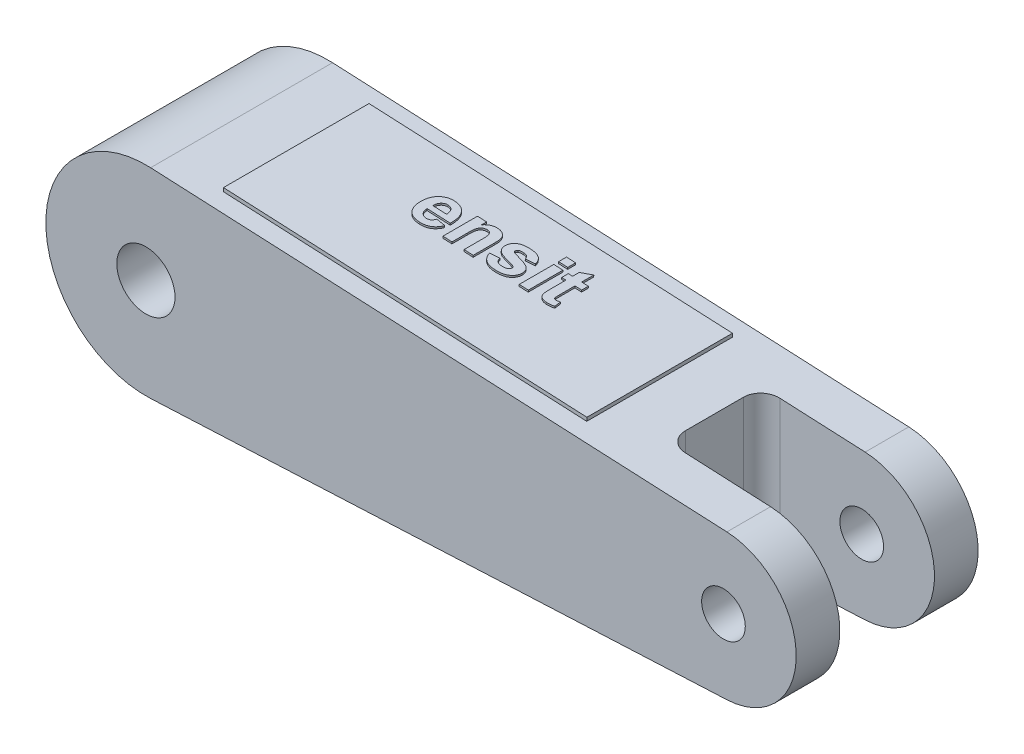
from build123d import *

# Parameters (mm, degrees)
BOSS_EXTRU_1_DEPTH           = 100
ESQUISSE2_R                  = 16
ESQUISSE2_R_2                = 12
ENL_V_MAT_EXTRU_1_DEPTH      = 376.274899241
ENL_V_MAT_EXTRU_2_DEPTH      = 376.274899241
ENL_V_MAT_EXTRU_2_DEPTH_BACK = 376.274899241
ESQUISSE4_W                  = 200
ESQUISSE4_H                  = 80
BOSS_EXTRU_2_DEPTH           = 2
ESQUISSE5_W                  = 5
ESQUISSE5_H                  = 4.333333333
ESQUISSE5_H_2                = 19
BOSS_EXTRU_3_DEPTH           = 1


with BuildPart() as part:
    # Esquisse1 → Boss.-Extru.1 (new body)
    with BuildSketch(Plane.XY):
        with BuildLine():
            Line((2.598425197, -54.938585589), (319.38976378, -39.955334974))
            ThreePointArc((319.38976378, -39.955334974), (357.5, 0), (319.38976378, 39.955334974))
            Line((319.38976378, 39.955334974), (2.598425197, 54.938585589))
            ThreePointArc((2.598425197, 54.938585589), (-55, 0), (2.598425197, -54.938585589))
        make_face()
    extrude(amount=-BOSS_EXTRU_1_DEPTH)

    # Esquisse2 → Enlèv. mat.-Extru.1 (cut, through all)
    with BuildSketch(Plane.XY):
        Circle(ESQUISSE2_R)
        with Locations((317.5, 0)):
            Circle(ESQUISSE2_R_2)
    extrude(amount=-ENL_V_MAT_EXTRU_1_DEPTH, mode=Mode.SUBTRACT)

    # Esquisse3 → Enlèv. mat.-Extru.2 (cut, two sides: drawn at the far end of the back side and taken through both)
    with BuildSketch(Plane(origin=(0, 0, 0), x_dir=(1, 0, 0), z_dir=(0, 1, 0)).offset(-ENL_V_MAT_EXTRU_2_DEPTH_BACK)):
        with BuildLine():
            Line((262.5, 66), (262.5, 34))
            ThreePointArc((262.5, 34), (265.428932188, 26.928932188), (272.5, 24))
            Line((272.5, 24), (370, 24))
            Line((370, 24), (370, 76))
            Line((370, 76), (272.5, 76))
            ThreePointArc((272.5, 76), (265.428932188, 73.071067812), (262.5, 66))
        make_face()
    extrude(amount=ENL_V_MAT_EXTRU_2_DEPTH + ENL_V_MAT_EXTRU_2_DEPTH_BACK, mode=Mode.SUBTRACT)

    # Esquisse4 → Boss.-Extru.2 (add)
    with BuildSketch(Plane(origin=(2.598425197, 54.938585589, 0), x_dir=(0.9988833743415652, -0.047244094488189, 0), z_dir=(0.047244094488189, 0.9988833743415652, 0))):
        with Locations((130, 50)):
            Rectangle(ESQUISSE4_W, ESQUISSE4_H)
    extrude(amount=BOSS_EXTRU_2_DEPTH)

    # Esquisse5 → Boss.-Extru.3 (add)
    # profile 1 of 6: a face of its own
    with BuildSketch(Plane(origin=(2.692913386, 56.936352337, 0), x_dir=(0.9988833743415652, -0.047244094488189024, 0), z_dir=(0.047244094488189024, 0.9988833743415652, 0))):
        with BuildLine():
            Line((101.333333333, 56), (106.333333333, 55.333333333))
            add(Edge.make_bspline(
                [(106.333333333, 55.333333333), (106.251551346, 55.108057373), (106.090750525, 54.665116811), (105.796966374, 54.033536922), (105.468573521, 53.444074923), (105.107150723, 52.893581334), (104.714043048, 52.381337922), (104.276251933, 51.918120116), (103.815104518, 51.486683863), (103.311311204, 51.107572755), (102.777495233, 50.766626183), (102.210973933, 50.468301541), (101.607216713, 50.22534271), (100.975366408, 50.021881126), (100.312554975, 49.859477833), (99.616078281, 49.745941967), (98.886829887, 49.676960923), (98.389043872, 49.670141324), (98.135416667, 49.666666667)],
                knots=[0, 0, 0, 0, 1.071172907, 2.106154283, 3.1104349, 4.085737425, 5.048416355, 5.993087888, 6.932482331, 7.868664062, 8.80754521, 9.762367971, 10.726735429, 11.713584758, 12.728370439, 13.774815933, 14.866245336, 16, 16, 16, 16], degree=3))
            add(Edge.make_bspline(
                [(98.135416667, 49.666666667), (97.739081692, 49.676448952), (96.96942933, 49.695445405), (95.855921218, 49.84810153), (94.821708921, 50.096644668), (93.864800572, 50.444777732), (92.988376739, 50.901440935), (92.191117703, 51.456733413), (91.471459927, 52.111861999), (91.06809061, 52.619092724), (90.864583333, 52.875)],
                knots=[0, 0, 0, 0, 1.150944905, 2.235047425, 3.25761485, 4.235688044, 5.185329112, 6.119879054, 7.051444229, 8, 8, 8, 8], degree=3))
            add(Edge.make_bspline(
                [(90.864583333, 52.875), (90.714394912, 53.092775543), (90.411959276, 53.531311911), (90.036020668, 54.24189506), (89.714561721, 54.992549804), (89.458467285, 55.785426333), (89.245581846, 56.617512111), (89.102349625, 57.494093352), (89.019794932, 58.413330485), (89.006687577, 59.039760609), (89, 59.359375)],
                knots=[0, 0, 0, 0, 0.92479112, 1.862259343, 2.806490716, 3.778329015, 4.774107667, 5.808532634, 6.881879269, 8, 8, 8, 8], degree=3))
            add(Edge.make_bspline(
                [(89, 59.359375), (89.00550005, 59.738248974), (89.016252058, 60.478906873), (89.14354719, 61.555569734), (89.323167913, 62.57369885), (89.597101625, 63.522716947), (89.939482118, 64.413449508), (90.369182941, 65.234442145), (90.864830929, 66.000628567), (91.444356698, 66.688869073), (92.07944613, 67.307705261), (92.755300416, 67.853003774), (93.476979063, 68.308472311), (94.233732851, 68.688627376), (95.038153592, 68.973181879), (95.880173234, 69.182651352), (96.763473382, 69.310215438), (97.365898547, 69.325546544), (97.671875, 69.333333333)],
                knots=[0, 0, 0, 0, 1.222152375, 2.389176539, 3.494777592, 4.555389183, 5.572001132, 6.56945427, 7.540785438, 8.511469914, 9.46642023, 10.399267108, 11.30862844, 12.215760073, 13.126777173, 14.056336669, 15.012798191, 16, 16, 16, 16], degree=3))
            add(Edge.make_bspline(
                [(97.671875, 69.333333333), (98.014324761, 69.326092962), (98.68446305, 69.311924315), (99.661522241, 69.178910403), (100.584034236, 68.962560133), (101.44898565, 68.651677207), (102.262016715, 68.2618451), (103.017080637, 67.778726915), (103.714216173, 67.206734623), (104.35170174, 66.546112115), (104.928637044, 65.801203276), (105.41969893, 64.957639402), (105.830785588, 64.024139438), (106.164059095, 62.998296685), (106.410444307, 61.877963519), (106.579031354, 60.666055507), (106.675173777, 59.362683863), (106.669561495, 58.463698678), (106.666666667, 58)],
                knots=[0, 0, 0, 0, 0.994942504, 1.946998194, 2.860087576, 3.744358974, 4.613292, 5.475605888, 6.343365869, 7.228414471, 8.138836547, 9.075277299, 10.058013037, 11.098483422, 12.205225682, 13.387753975, 14.652597341, 16, 16, 16, 16], degree=3))
            Line((106.666666667, 58), (94, 58))
            add(Edge.make_bspline(
                [(94, 58), (94.008199962, 57.821037197), (94.024167919, 57.472539215), (94.084653152, 56.963129329), (94.189363423, 56.486298141), (94.32639526, 56.039152777), (94.489339458, 55.621379472), (94.696617372, 55.236989896), (94.935428179, 54.881080254), (95.211508522, 54.559454391), (95.513793979, 54.273945198), (95.8327732, 54.023036711), (96.167956574, 53.803637158), (96.528003796, 53.636769797), (96.900944375, 53.495869132), (97.293491979, 53.405553837), (97.703019171, 53.34553951), (97.982414394, 53.337457751), (98.125, 53.333333333)],
                knots=[0, 0, 0, 0, 1.231756261, 2.398624542, 3.522625857, 4.583815436, 5.612473245, 6.600564899, 7.580690863, 8.554470542, 9.508734211, 10.435415665, 11.342824763, 12.255949018, 13.158633635, 14.07945191, 15.019874036, 16, 16, 16, 16], degree=3))
            add(Edge.make_bspline(
                [(98.125, 53.333333333), (98.314780387, 53.341748279), (98.682356679, 53.358046773), (99.21219318, 53.472241968), (99.692930926, 53.673484288), (100.129607279, 53.954039961), (100.518162263, 54.326618252), (100.843925361, 54.801171992), (101.128749372, 55.362886135), (101.262894904, 55.780641163), (101.333333333, 56)],
                knots=[0, 0, 0, 0, 1.004430367, 1.945431754, 2.851730883, 3.749038912, 4.678525969, 5.68064125, 6.782128749, 8, 8, 8, 8], degree=3))
        make_face()
        with BuildLine():
            add(Edge.make_bspline(
                [(101.666666667, 61), (101.658061356, 61.184132636), (101.641301912, 61.5427438), (101.58663317, 62.065598002), (101.492785492, 62.552935638), (101.369348251, 63.007384942), (101.204644577, 63.423351472), (101.020760971, 63.812757437), (100.795251193, 64.163477668), (100.536926211, 64.47470636), (100.264433584, 64.759179415), (99.963217183, 64.995737189), (99.658651912, 65.207438599), (99.334984393, 65.376835468), (98.99556772, 65.506254798), (98.641544933, 65.601407201), (98.272297649, 65.652393875), (98.022709098, 65.661856459), (97.895833333, 65.666666667)],
                knots=[0, 0, 0, 0, 1.317025077, 2.564998298, 3.752245872, 4.859831213, 5.924126069, 6.944952788, 7.932526842, 8.893486968, 9.832088588, 10.740700482, 11.624936399, 12.479435602, 13.343337491, 14.21592381, 15.09308328, 16, 16, 16, 16], degree=3))
            add(Edge.make_bspline(
                [(97.895833333, 65.666666667), (97.760244573, 65.662265414), (97.493060148, 65.653592524), (97.101242149, 65.597003527), (96.72985607, 65.49663307), (96.376071568, 65.360786734), (96.040646816, 65.181891339), (95.723574315, 64.962498201), (95.42366121, 64.705354097), (95.242949819, 64.510539332), (95.151041667, 64.411458333)],
                knots=[0, 0, 0, 0, 1.043516863, 2.056302107, 3.038302912, 3.998520634, 4.966791607, 5.956307719, 6.960596886, 8, 8, 8, 8], degree=3))
            add(Edge.make_bspline(
                [(95.151041667, 64.411458333), (95.065377095, 64.303742962), (94.893266292, 64.087329355), (94.674979049, 63.728506985), (94.4848357, 63.344967894), (94.343137583, 62.926356908), (94.218697887, 62.486240303), (94.145702327, 62.014099841), (94.096529212, 61.516690364), (94.091254469, 61.175483046), (94.088541667, 61)],
                knots=[0, 0, 0, 0, 0.903873942, 1.815995408, 2.755131859, 3.711650387, 4.716574161, 5.757841734, 6.846857195, 8, 8, 8, 8], degree=3))
            Line((94.088541667, 61), (101.666666667, 61))
        make_face(mode=Mode.SUBTRACT)
    # profile 2 of 6: a face of its own
    with BuildSketch(Plane(origin=(2.692913386, 56.936352337, 0), x_dir=(0.9988833743415652, -0.047244094488189024, 0), z_dir=(0.047244094488189024, 0.9988833743415652, 0))):
        with BuildLine():
            Line((127.333333333, 50), (122.333333333, 50))
            Line((122.333333333, 50), (122.333333333, 59.75))
            add(Edge.make_bspline(
                [(122.333333333, 59.75), (122.332585682, 59.996541694), (122.331158659, 60.467109366), (122.313736397, 61.137240213), (122.29497956, 61.739876647), (122.264826402, 62.273148929), (122.223410781, 62.740441495), (122.174127701, 63.138846595), (122.112049553, 63.469173929), (122.023970742, 63.813708612), (121.885675403, 64.17930852), (121.661231667, 64.557973135), (121.40104635, 64.894201837), (121.085861449, 65.169254941), (120.732624332, 65.391052651), (120.344783168, 65.55456302), (119.919503854, 65.650045222), (119.625489211, 65.661013682), (119.473958333, 65.666666667)],
                knots=[0, 0, 0, 0, 1.585090075, 3.025419896, 4.30986405, 5.461533023, 6.458985685, 7.325703005, 8.041573048, 8.618245387, 9.611190897, 10.541623111, 11.439410311, 12.333024322, 13.215695708, 14.111259627, 15.026570636, 16, 16, 16, 16], degree=3))
            add(Edge.make_bspline(
                [(119.473958333, 65.666666667), (119.278862456, 65.656982504), (118.894665917, 65.637911768), (118.330533468, 65.505817374), (117.803643565, 65.271865931), (117.311805544, 64.959558041), (116.878113883, 64.571759593), (116.509367701, 64.118851666), (116.218529499, 63.606516347), (116.037329156, 63.128143945), (115.929806766, 62.695150786), (115.856634273, 62.304072264), (115.804210995, 61.847745066), (115.748839665, 61.330807722), (115.717605637, 60.748396278), (115.682754298, 60.106275531), (115.669922774, 59.399352088), (115.667784695, 58.907984058), (115.666666667, 58.651041667)],
                knots=[0, 0, 0, 0, 1.032418065, 2.033110358, 3.045378521, 4.070039643, 5.104744895, 6.110696385, 7.147805894, 8.209255037, 8.806501049, 9.507534436, 10.313289552, 11.236712342, 12.258650821, 13.399345464, 14.640085731, 16, 16, 16, 16], degree=3))
            Line((115.666666667, 58.651041667), (115.666666667, 50))
            Line((115.666666667, 50), (110.666666667, 50))
            Line((110.666666667, 50), (110.666666667, 69))
            Line((110.666666667, 69), (115.666666667, 69))
            Line((115.666666667, 69), (115.666666667, 66.260416667))
            add(Edge.make_bspline(
                [(115.666666667, 66.260416667), (115.8599729, 66.503980815), (116.236551018, 66.978465921), (116.867011406, 67.609064612), (117.534727307, 68.144228654), (118.242710039, 68.581077305), (118.990596425, 68.918280785), (119.774961038, 69.155772489), (120.596450364, 69.309409478), (121.157289429, 69.325264493), (121.442708333, 69.333333333)],
                knots=[0, 0, 0, 0, 1.096260936, 2.135615983, 3.138008533, 4.108575778, 5.062498258, 6.023394349, 6.994077526, 8, 8, 8, 8], degree=3))
            add(Edge.make_bspline(
                [(121.442708333, 69.333333333), (121.693181673, 69.327035299), (122.186436393, 69.314632642), (122.907578867, 69.195584693), (123.596139305, 69.00866248), (124.242517639, 68.747938011), (124.836755467, 68.437026151), (125.358830569, 68.073506597), (125.807582082, 67.672616044), (126.175614877, 67.222535481), (126.475249785, 66.738223306), (126.736053542, 66.22999412), (126.937587444, 65.6858676), (127.093144652, 65.094621843), (127.198602046, 64.424449844), (127.282670386, 63.646001656), (127.325086861, 62.740042069), (127.330469837, 62.093781121), (127.333333333, 61.75)],
                knots=[0, 0, 0, 0, 1.087471829, 2.141547729, 3.166311014, 4.181815879, 5.163737, 6.073971965, 6.939083136, 7.769667735, 8.590016746, 9.409741311, 10.247555639, 11.105633939, 12.06171977, 13.192085209, 14.506318385, 16, 16, 16, 16], degree=3))
            Line((127.333333333, 61.75), (127.333333333, 50))
        make_face()
    # profile 3 of 6: a face of its own
    with BuildSketch(Plane(origin=(2.692913386, 56.936352337, 0), x_dir=(0.9988833743415652, -0.047244094488189024, 0), z_dir=(0.047244094488189024, 0.9988833743415652, 0))):
        with BuildLine():
            Line((130.666666667, 55.666666667), (135.666666667, 56.333333333))
            add(Edge.make_bspline(
                [(135.666666667, 56.333333333), (135.726671554, 56.099799795), (135.842255954, 55.649955878), (136.13502515, 55.038399366), (136.502045033, 54.508802375), (136.96451228, 54.07415773), (137.519454659, 53.731981716), (138.175112289, 53.503750691), (138.922081274, 53.354172389), (139.454038728, 53.340525243), (139.734375, 53.333333333)],
                knots=[0, 0, 0, 0, 1.039319445, 2.001988807, 2.911187514, 3.807680854, 4.723381073, 5.705509029, 6.790826147, 8, 8, 8, 8], degree=3))
            add(Edge.make_bspline(
                [(139.734375, 53.333333333), (140.040775832, 53.33873967), (140.617076367, 53.348908295), (141.416146462, 53.490029427), (142.110410441, 53.686059042), (142.491674414, 53.920461862), (142.671875, 54.03125)],
                knots=[0, 0, 0, 0, 1.198418162, 2.254070348, 3.174803892, 4, 4, 4, 4], degree=3))
            add(Edge.make_bspline(
                [(142.671875, 54.03125), (142.77466044, 54.114692068), (142.974556462, 54.276969309), (143.177409243, 54.603468809), (143.312433851, 54.961840107), (143.326233275, 55.217444932), (143.333333333, 55.348958333)],
                knots=[0, 0, 0, 0, 1.030872991, 2.004830756, 2.973448591, 4, 4, 4, 4], degree=3))
            add(Edge.make_bspline(
                [(143.333333333, 55.348958333), (143.329929878, 55.437957969), (143.3232821, 55.611795971), (143.253720724, 55.860391905), (143.136968442, 56.085077537), (143.028672415, 56.211944862), (142.973958333, 56.276041667)],
                knots=[0, 0, 0, 0, 1.045349703, 2.041822997, 3.010676005, 4, 4, 4, 4], degree=3))
            add(Edge.make_bspline(
                [(142.973958333, 56.276041667), (142.89418893, 56.336350479), (142.708771182, 56.476533604), (142.337836464, 56.633982243), (141.857718861, 56.787141841), (141.495569802, 56.874141967), (141.296875, 56.921875)],
                knots=[0, 0, 0, 0, 0.66031085, 1.534841007, 2.647478808, 4, 4, 4, 4], degree=3))
            add(Edge.make_bspline(
                [(141.296875, 56.921875), (140.812023969, 57.027430296), (139.888973623, 57.228384498), (138.576647927, 57.548088803), (137.404081766, 57.857548174), (136.368341496, 58.159172789), (135.473012887, 58.450494367), (134.718031933, 58.744900076), (134.095717876, 59.019318065), (133.744842927, 59.232957064), (133.588541667, 59.328125)],
                knots=[0, 0, 0, 0, 1.469089687, 2.796825535, 3.998745421, 5.059265209, 5.990657066, 6.784841839, 7.458693894, 8, 8, 8, 8], degree=3))
            add(Edge.make_bspline(
                [(133.588541667, 59.328125), (133.410232679, 59.458101305), (133.062090435, 59.711875628), (132.598367288, 60.148842699), (132.205164447, 60.623944736), (131.883670423, 61.138650783), (131.638284378, 61.691728343), (131.458851282, 62.280610331), (131.354945788, 62.90778957), (131.340624908, 63.338163719), (131.333333333, 63.557291667)],
                knots=[0, 0, 0, 0, 1.056974227, 2.063706289, 3.045111424, 4.005796011, 4.963194591, 5.937303459, 6.949763919, 8, 8, 8, 8], degree=3))
            add(Edge.make_bspline(
                [(131.333333333, 63.557291667), (131.33970959, 63.757242736), (131.352303624, 64.152175183), (131.440863514, 64.7310865), (131.593710436, 65.284930709), (131.809028754, 65.814362226), (132.085049122, 66.319396778), (132.423444558, 66.798852572), (132.821150245, 67.250981132), (133.275221222, 67.682157619), (133.796123998, 68.072668463), (134.385373781, 68.412889662), (135.042305588, 68.700153478), (135.765784197, 68.930291462), (136.554601694, 69.113981092), (137.40981039, 69.240684425), (138.331844475, 69.319613827), (138.968581527, 69.328666098), (139.296875, 69.333333333)],
                knots=[0, 0, 0, 0, 0.866638136, 1.711736386, 2.531524902, 3.351865931, 4.183724929, 5.020979167, 5.890357771, 6.790086018, 7.73080449, 8.705352504, 9.73310627, 10.832638366, 11.99182341, 13.240303911, 14.577136024, 16, 16, 16, 16], degree=3))
            add(Edge.make_bspline(
                [(139.296875, 69.333333333), (139.609497033, 69.329621968), (140.216302795, 69.322418133), (141.094197755, 69.258984072), (141.91109484, 69.15947178), (142.662951965, 69.004348788), (143.357877242, 68.824796899), (143.985596296, 68.584456677), (144.558879189, 68.320881454), (145.062595547, 67.994267254), (145.523393337, 67.637666999), (145.938972593, 67.234651043), (146.319281, 66.793499279), (146.675011538, 66.321158554), (146.971367888, 65.794211875), (147.245503877, 65.236054983), (147.480954425, 64.635012337), (147.603910263, 64.214585158), (147.666666667, 64)],
                knots=[0, 0, 0, 0, 1.380550213, 2.679676202, 3.885648221, 5.011984379, 6.068504557, 7.051214125, 7.977245523, 8.849391706, 9.696088241, 10.547493682, 11.400830533, 12.26732929, 13.153751704, 14.065965736, 15.012872933, 16, 16, 16, 16], degree=3))
            Line((147.666666667, 64), (142.666666667, 63.333333333))
            add(Edge.make_bspline(
                [(142.666666667, 63.333333333), (142.61703901, 63.512555104), (142.520698524, 63.860472245), (142.283027854, 64.331483452), (141.986521452, 64.73777718), (141.626288862, 65.077120679), (141.193093279, 65.353183093), (140.672759099, 65.533398794), (140.076452298, 65.650956668), (139.651692589, 65.661232759), (139.427083333, 65.666666667)],
                knots=[0, 0, 0, 0, 1.018425325, 1.977034519, 2.876390575, 3.766006025, 4.677889232, 5.672509542, 6.769243204, 8, 8, 8, 8], degree=3))
            add(Edge.make_bspline(
                [(139.427083333, 65.666666667), (139.148688822, 65.663048299), (138.631281885, 65.656323424), (137.921886208, 65.549192448), (137.324143261, 65.400422225), (137.00224482, 65.21177882), (136.854166667, 65.125)],
                knots=[0, 0, 0, 0, 1.252081424, 2.327041614, 3.230413832, 4, 4, 4, 4], degree=3))
            add(Edge.make_bspline(
                [(136.854166667, 65.125), (136.774033184, 65.059126753), (136.620261564, 64.93271972), (136.454244869, 64.68775525), (136.348797432, 64.416286359), (136.338546541, 64.223197522), (136.333333333, 64.125)],
                knots=[0, 0, 0, 0, 1.057832138, 2.029920023, 2.998093444, 4, 4, 4, 4], degree=3))
            add(Edge.make_bspline(
                [(136.333333333, 64.125), (136.339669277, 64.040881312), (136.352305866, 63.873112567), (136.445564307, 63.63226525), (136.601283418, 63.412048599), (136.743318442, 63.295445232), (136.817708333, 63.234375)],
                knots=[0, 0, 0, 0, 0.958252903, 1.911167308, 2.905987877, 4, 4, 4, 4], degree=3))
            add(Edge.make_bspline(
                [(136.817708333, 63.234375), (136.887855094, 63.189050783), (137.0554465, 63.080764253), (137.378172662, 62.949469215), (137.797118254, 62.798188835), (138.317628487, 62.634470186), (138.936872988, 62.451742633), (139.657754043, 62.259616593), (140.479976274, 62.058636539), (141.375647283, 61.848222227), (142.286590063, 61.630391942), (143.151297821, 61.393240424), (143.941764845, 61.137011466), (144.658523406, 60.869126244), (145.303022077, 60.586120075), (145.876869179, 60.298477022), (146.378334463, 59.99330838), (146.668754012, 59.76158143), (146.807291667, 59.651041667)],
                knots=[0, 0, 0, 0, 0.374473465, 0.894674728, 1.558250729, 2.377018991, 3.344303564, 4.458456515, 5.727543487, 7.146141891, 8.591136569, 9.934411183, 11.172377707, 12.322386231, 13.369924362, 14.332482298, 15.204550818, 16, 16, 16, 16], degree=3))
            add(Edge.make_bspline(
                [(146.807291667, 59.651041667), (146.930353584, 59.53780862), (147.173514881, 59.314068447), (147.479736524, 58.925582666), (147.751197253, 58.514534802), (147.961375849, 58.063490847), (148.130872648, 57.584268684), (148.250986337, 57.071034109), (148.316102205, 56.524249114), (148.327513661, 56.149466756), (148.333333333, 55.958333333)],
                knots=[0, 0, 0, 0, 0.971012965, 1.9186502, 2.868006896, 3.82989672, 4.803792202, 5.820095146, 6.888280979, 8, 8, 8, 8], degree=3))
            add(Edge.make_bspline(
                [(148.333333333, 55.958333333), (148.325578685, 55.746196921), (148.310302151, 55.328291556), (148.211310348, 54.711763688), (148.035069902, 54.121505452), (147.803169456, 53.548575375), (147.490191635, 53.004106778), (147.112331802, 52.482851446), (146.673131034, 51.978712246), (146.163023321, 51.505695323), (145.584031292, 51.073725949), (144.941639646, 50.69108734), (144.231080178, 50.373606982), (143.456405883, 50.11364583), (142.615988098, 49.913058918), (141.710948208, 49.766722272), (140.741040977, 49.686334435), (140.073057302, 49.673350858), (139.729166667, 49.666666667)],
                knots=[0, 0, 0, 0, 0.853005228, 1.680406763, 2.502135431, 3.325285981, 4.159928718, 5.020072903, 5.910500533, 6.844018396, 7.811498054, 8.809909951, 9.84399402, 10.934451331, 12.090792638, 13.314110396, 14.617253208, 16, 16, 16, 16], degree=3))
            add(Edge.make_bspline(
                [(139.729166667, 49.666666667), (139.41482042, 49.672059282), (138.802615098, 49.682561675), (137.90938718, 49.752615266), (137.067922778, 49.885163849), (136.275709817, 50.060388381), (135.532280276, 50.282445244), (134.840531249, 50.560203494), (134.197216231, 50.887040584), (133.608091029, 51.269125375), (133.069660148, 51.693305549), (132.578113477, 52.153123311), (132.132744065, 52.647951709), (131.742853924, 53.182643813), (131.394533013, 53.748856824), (131.099718201, 54.352720456), (130.85056421, 54.993688062), (130.72868318, 55.439715365), (130.666666667, 55.666666667)],
                knots=[0, 0, 0, 0, 1.275954772, 2.484986887, 3.63311568, 4.730696379, 5.776212371, 6.778566547, 7.752400714, 8.700396387, 9.623767345, 10.531135067, 11.42942751, 12.321590653, 13.213503293, 14.124285009, 15.045583181, 16, 16, 16, 16], degree=3))
        make_face()
    # profile 4 of 6: a face of its own
    with BuildSketch(Plane(origin=(2.692913386, 56.936352337, 0), x_dir=(0.9988833743415652, -0.047244094488189024, 0), z_dir=(0.047244094488189024, 0.9988833743415652, 0))):
        with Locations((155.166666667, 73.833333334)):
            Rectangle(ESQUISSE5_W, ESQUISSE5_H)
    # profile 5 of 6: a face of its own
    with BuildSketch(Plane(origin=(2.692913386, 56.936352337, 0), x_dir=(0.9988833743415652, -0.047244094488189024, 0), z_dir=(0.047244094488189024, 0.9988833743415652, 0))):
        with Locations((155.166666667, 59.5)):
            Rectangle(ESQUISSE5_W, ESQUISSE5_H_2)
    # profile 6 of 6: a face of its own
    with BuildSketch(Plane(origin=(2.692913386, 56.936352337, 0), x_dir=(0.9988833743415652, -0.047244094488189024, 0), z_dir=(0.047244094488189024, 0.9988833743415652, 0))):
        with BuildLine():
            Line((171.666666667, 69), (171.666666667, 65.333333333))
            Line((171.666666667, 65.333333333), (168, 65.333333333))
            Line((168, 65.333333333), (168, 57.166666667))
            add(Edge.make_bspline(
                [(168, 57.166666667), (167.999619529, 56.970485715), (167.998902342, 56.600684623), (168.003620461, 56.078071952), (168.014709656, 55.61975873), (168.026224826, 55.22572278), (168.032016808, 54.89543221), (168.054527775, 54.631629156), (168.074977454, 54.432017793), (168.10671423, 54.186186574), (168.25249048, 53.888790383), (168.494601807, 53.628868252), (168.743482915, 53.477989504), (168.954747853, 53.394757948), (169.184786063, 53.340422852), (169.345173404, 53.335729984), (169.427083333, 53.333333333)],
                knots=[0, 0, 0, 0, 1.772607892, 3.341365874, 4.72216035, 5.914769548, 6.903535532, 7.706019004, 8.305410619, 8.718065781, 9.939723765, 11.215765275, 11.877591902, 12.553399735, 13.261220211, 14, 14, 14, 14], degree=3))
            add(Edge.make_bspline(
                [(169.427083333, 53.333333333), (169.561089867, 53.340912278), (169.857426561, 53.357672052), (170.3382289, 53.453963178), (170.895479451, 53.607206718), (171.288884938, 53.740805987), (171.5, 53.8125)],
                knots=[0, 0, 0, 0, 0.753421026, 1.666085143, 2.747540144, 4, 4, 4, 4], degree=3))
            Line((171.5, 53.8125), (172, 50.328125))
            add(Edge.make_bspline(
                [(172, 50.328125), (171.696369729, 50.223960742), (171.078704203, 50.012062664), (170.09486648, 49.81928069), (169.057397002, 49.68833904), (168.344199016, 49.674003798), (167.979166667, 49.666666667)],
                knots=[0, 0, 0, 0, 0.939547081, 1.911291127, 2.930947196, 4, 4, 4, 4], degree=3))
            add(Edge.make_bspline(
                [(167.979166667, 49.666666667), (167.754978092, 49.673328124), (167.317181548, 49.68633665), (166.676103736, 49.768790313), (166.07059285, 49.914988835), (165.505000284, 50.116493619), (164.994214437, 50.364111968), (164.544340675, 50.642057661), (164.175316546, 50.965416381), (163.867065987, 51.322319401), (163.623932079, 51.736729678), (163.430909423, 52.208308543), (163.265022876, 52.739132928), (163.197066455, 53.118779403), (163.161458333, 53.317708333)],
                knots=[0, 0, 0, 0, 1.203015215, 2.349253984, 3.460901624, 4.539344044, 5.564274864, 6.502382232, 7.367332183, 8.186789841, 9.022345106, 9.932420497, 10.916620053, 12, 12, 12, 12], degree=3))
            add(Edge.make_bspline(
                [(163.161458333, 53.317708333), (163.148972881, 53.400991025), (163.121194853, 53.586280991), (163.08350604, 53.893300839), (163.060250547, 54.258481317), (163.04119349, 54.680515023), (163.016748088, 55.159491168), (163.011579688, 55.694472967), (162.99662113, 56.286391519), (162.998836534, 56.699640351), (163, 56.916666667)],
                knots=[0, 0, 0, 0, 0.560521704, 1.24706641, 2.057998689, 2.995119087, 4.059211621, 5.249632546, 6.555586685, 8, 8, 8, 8], degree=3))
            Line((163, 56.916666667), (163, 65.333333333))
            Line((163, 65.333333333), (160.666666667, 65.333333333))
            Line((160.666666667, 65.333333333), (160.666666667, 69))
            Line((160.666666667, 69), (163, 69))
            Line((163, 69), (163, 72.666666667))
            Line((163, 72.666666667), (168, 75.666666667))
            Line((168, 75.666666667), (168, 69))
            Line((168, 69), (171.666666667, 69))
        make_face()
    extrude(amount=BOSS_EXTRU_3_DEPTH)


solid = part.part
